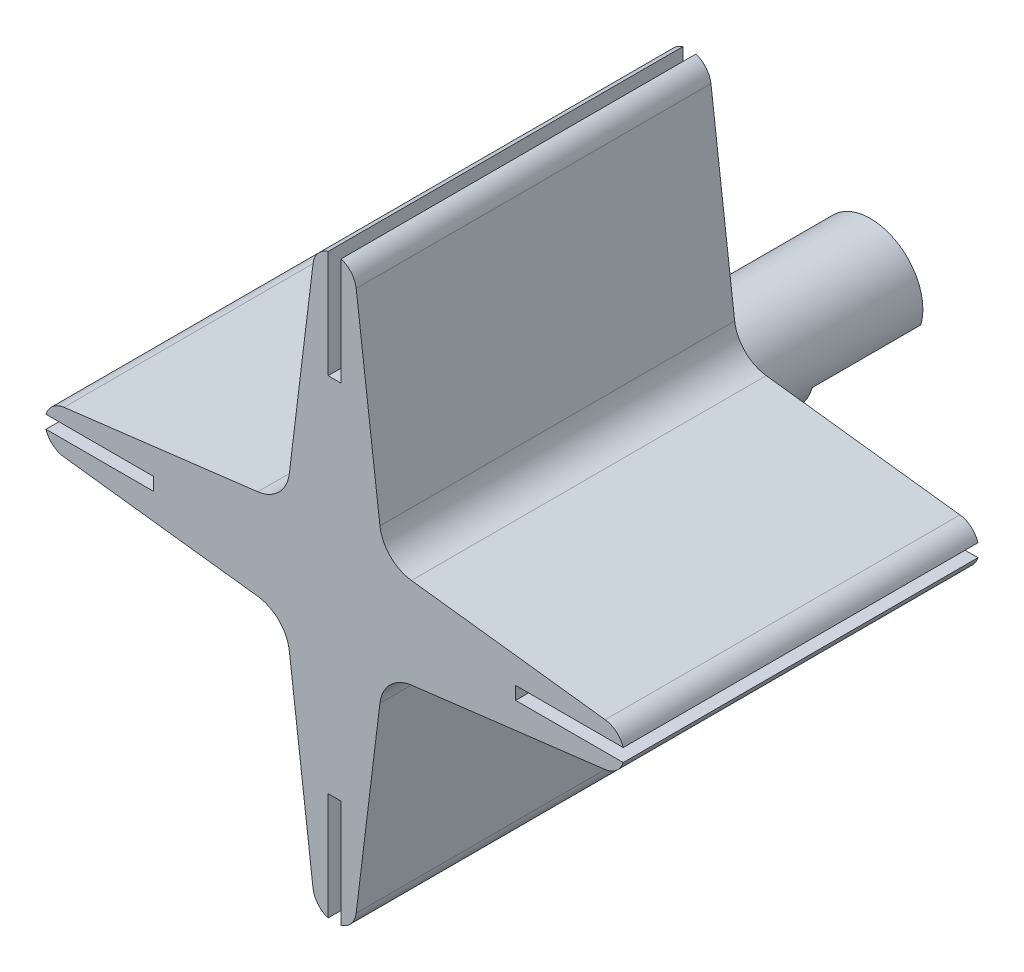
from build123d import *

# Parameters (mm, degrees)
BOSS_EXTRUDE1_DEPTH = 49
FILLET1_R           = 5
SKETCH2_R           = 7.25
BOSS_EXTRUDE2_DEPTH = 25
CUT_EXTRUDE1_START  = -15
CUT_EXTRUDE1_DEPTH  = 15
SKETCH4_W           = 25
SKETCH4_H           = 1.7875
SKETCH4_W_2         = 1.7875
SKETCH4_H_2         = 25
CUT_EXTRUDE2_DEPTH  = 49


with BuildPart() as part:
    # Sketch1 → Boss-Extrude1 (new body)
    with BuildSketch(Plane.XY):
        with BuildLine():
            Line((-6.731298149, 6.731298149), (-2.97772961, 37.364864865))
            ThreePointArc((-2.97772961, 37.364864865), (0, 40), (2.97772961, 37.364864865))
            Line((2.97772961, 37.364864865), (6.731298149, 6.731298149))
            Line((6.731298149, 6.731298149), (37.364864865, 2.97772961))
            ThreePointArc((37.364864865, 2.97772961), (40, 0), (37.364864865, -2.97772961))
            Line((37.364864865, -2.97772961), (6.731298149, -6.731298149))
            Line((6.731298149, -6.731298149), (2.97772961, -37.364864865))
            ThreePointArc((2.97772961, -37.364864865), (0, -40), (-2.97772961, -37.364864865))
            Line((-2.97772961, -37.364864865), (-6.731298149, -6.731298149))
            Line((-6.731298149, -6.731298149), (-37.364864865, -2.97772961))
            ThreePointArc((-37.364864865, -2.97772961), (-40, 0), (-37.364864865, 2.97772961))
            Line((-37.364864865, 2.97772961), (-6.731298149, 6.731298149))
        make_face()
    extrude(amount=BOSS_EXTRUDE1_DEPTH)

    # Fillet1
    fillet1_edges = [part.edges().sort_by_distance(p)[0] for p in [
        (-6.731298149, 6.731298149, 24.5),
        (6.731298149, 6.731298149, 24.5),
        (6.731298149, -6.731298149, 24.5),
        (-6.731298149, -6.731298149, 24.5),
    ]]
    fillet(fillet1_edges, radius=FILLET1_R)

    # Sketch2 → Boss-Extrude2 (add)
    with BuildSketch(Plane(origin=(0, 0, 0), x_dir=(-1, 0, 0), z_dir=(0, 0, -1))):
        with Locations(Location((0, 0, 0), (0, 0, 180))):
            Circle(SKETCH2_R)
    extrude(amount=BOSS_EXTRUDE2_DEPTH)

    # Sketch3 → Cut-Extrude1 (cut)
    with BuildSketch(Plane(origin=(0, 0, -25), x_dir=(-1, 0, 0), z_dir=(0, 0, -1)).offset(CUT_EXTRUDE1_START)):
        with BuildLine():
            Line((6.968679932, -2), (-6.968679932, -2))
            ThreePointArc((-6.968679932, -2), (0, -7.25), (6.968679932, -2))
        make_face()
    extrude(amount=CUT_EXTRUDE1_DEPTH, mode=Mode.SUBTRACT)

    # Sketch4 → Cut-Extrude2 (cut)
    with BuildSketch(Plane.XY.offset(49)):
        with Locations((37.5, 0)):
            Rectangle(SKETCH4_W, SKETCH4_H)
        with Locations((0, 37.5)):
            Rectangle(SKETCH4_W_2, SKETCH4_H_2)
        with Locations((0, -37.5)):
            Rectangle(SKETCH4_W_2, SKETCH4_H_2)
        with Locations((-37.5, 0)):
            Rectangle(SKETCH4_W, SKETCH4_H)
    extrude(amount=-CUT_EXTRUDE2_DEPTH, mode=Mode.SUBTRACT)


solid = part.part
